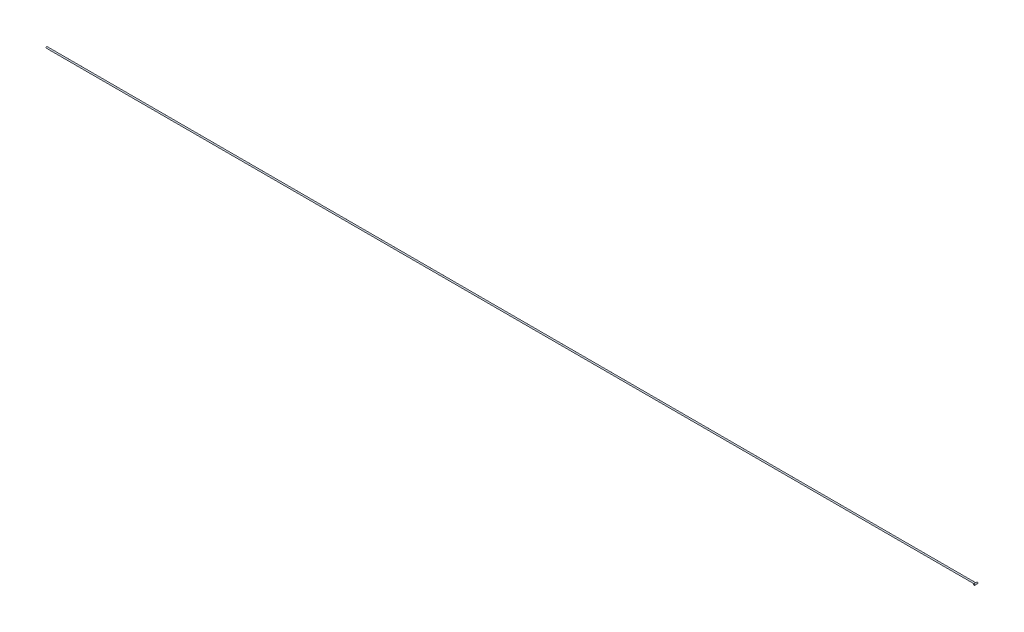
from build123d import *

# Parameters (mm, degrees)
BALAYAGE1_PROFILE_R = 1
BALAYAGE2_PROFILE_R = 1


with BuildPart() as part:
    # Balayage1: sweep along a path in Esquisse1
    with BuildLine(Plane.XY) as balayage1_path:
        Line((-716, 0), (716, 0))
    # Balayage1 profile (on start of the path) → Balayage1 (sweep)
    with BuildSketch(Plane(origin=(-716, 0, 0), x_dir=(0, 0, 1), z_dir=(1, 0, 0))):
        Circle(BALAYAGE1_PROFILE_R)
    sweep(path=balayage1_path.line)

    # Balayage2: sweep along a path in Esquisse16
    with BuildLine(Plane(origin=(716, 0, 0), x_dir=(0, 0, -1), z_dir=(1, 0, 0))) as balayage2_path:
        Line((-2.5, 0), (2.5, 0))
    # Balayage2 profile (on start of the path) → Balayage2 (sweep)
    with BuildSketch(Plane(origin=(716, 0, 2.5), x_dir=(-1, 0, 0), z_dir=(0, 0, -1))):
        Circle(BALAYAGE2_PROFILE_R)
    sweep(path=balayage2_path.line)


solid = part.part
